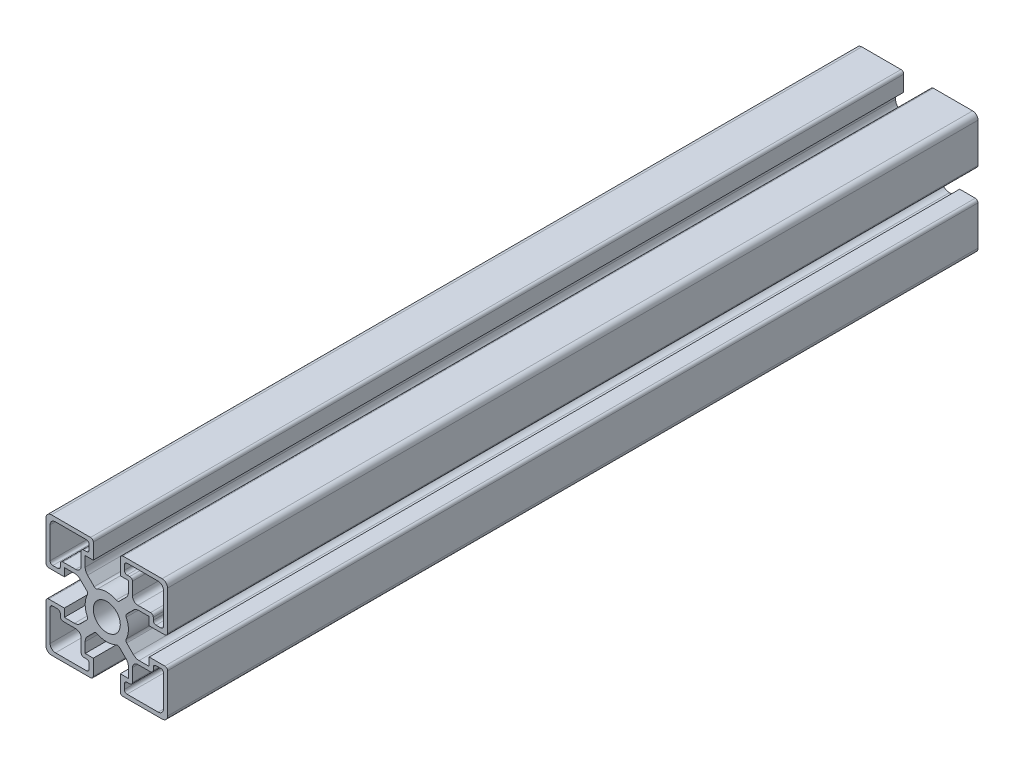
from build123d import *

# Parameters (mm, degrees)
SKETCH1_R           = 5
BOSS_EXTRUDE1_DEPTH = 300


with BuildPart() as part:
    # Sketch1 → Boss-Extrude1 (new body)
    with BuildSketch(Plane.XY):
        with BuildLine():
            Line((-5, -15.705854984), (-8, -15.705854984))
            Line((-8, -15.705854984), (-8, -11.948495671))
            ThreePointArc((-8, -11.948495671), (-7.771638598, -10.800445374), (-7.121320344, -9.827175327))
            Line((-7.121320344, -9.827175327), (-4.66838954, -7.374244523))
            ThreePointArc((-4.66838954, -7.374244523), (-4.125357909, -7.094903463), (-3.52114023, -7.183423382))
            ThreePointArc((-3.52114023, -7.183423382), (0, -8), (3.52114023, -7.183423382))
            ThreePointArc((3.52114023, -7.183423382), (4.125357909, -7.094903463), (4.66838954, -7.374244523))
            Line((4.66838954, -7.374244523), (7.121320344, -9.827175327))
            ThreePointArc((7.121320344, -9.827175327), (7.771638598, -10.800445374), (8, -11.948495671))
            Line((8, -11.948495671), (8, -15.705854984))
            Line((8, -15.705854984), (5, -15.705854984))
            Line((5, -15.705854984), (5, -21.5))
            ThreePointArc((5, -21.5), (5.292893219, -22.207106781), (6, -22.5))
            Line((6, -22.5), (20.5, -22.5))
            ThreePointArc((20.5, -22.5), (21.914213562, -21.914213562), (22.5, -20.5))
            Line((22.5, -20.5), (22.5, -6))
            ThreePointArc((22.5, -6), (22.207106781, -5.292893219), (21.5, -5))
            Line((21.5, -5), (15.705854984, -5))
            Line((15.705854984, -5), (15.705854984, -8))
            Line((15.705854984, -8), (11.948495671, -8))
            ThreePointArc((11.948495671, -8), (10.800445374, -7.771638598), (9.827175327, -7.121320344))
            Line((9.827175327, -7.121320344), (7.374244523, -4.66838954))
            ThreePointArc((7.374244523, -4.66838954), (7.094903463, -4.125357909), (7.183423382, -3.52114023))
            ThreePointArc((7.183423382, -3.52114023), (8, 0), (7.183423382, 3.52114023))
            ThreePointArc((7.183423382, 3.52114023), (7.094903463, 4.125357909), (7.374244523, 4.66838954))
            Line((7.374244523, 4.66838954), (9.827175327, 7.121320344))
            ThreePointArc((9.827175327, 7.121320344), (10.800445374, 7.771638598), (11.948495671, 8))
            Line((11.948495671, 8), (15.705854984, 8))
            Line((15.705854984, 8), (15.705854984, 5))
            Line((15.705854984, 5), (21.5, 5))
            ThreePointArc((21.5, 5), (22.207106781, 5.292893219), (22.5, 6))
            Line((22.5, 6), (22.5, 20.5))
            ThreePointArc((22.5, 20.5), (21.914213562, 21.914213562), (20.5, 22.5))
            Line((20.5, 22.5), (6, 22.5))
            ThreePointArc((6, 22.5), (5.292893219, 22.207106781), (5, 21.5))
            Line((5, 21.5), (5, 15.705854984))
            Line((5, 15.705854984), (8, 15.705854984))
            Line((8, 15.705854984), (8, 11.948495671))
            ThreePointArc((8, 11.948495671), (7.771638598, 10.800445374), (7.121320344, 9.827175327))
            Line((7.121320344, 9.827175327), (4.66838954, 7.374244523))
            ThreePointArc((4.66838954, 7.374244523), (4.125357909, 7.094903463), (3.52114023, 7.183423382))
            ThreePointArc((3.52114023, 7.183423382), (0, 8), (-3.52114023, 7.183423382))
            ThreePointArc((-3.52114023, 7.183423382), (-4.125357909, 7.094903463), (-4.66838954, 7.374244523))
            Line((-4.66838954, 7.374244523), (-7.121320344, 9.827175327))
            ThreePointArc((-7.121320344, 9.827175327), (-7.771638598, 10.800445374), (-8, 11.948495671))
            Line((-8, 11.948495671), (-8, 15.705854984))
            Line((-8, 15.705854984), (-5, 15.705854984))
            Line((-5, 15.705854984), (-5, 21.5))
            ThreePointArc((-5, 21.5), (-5.292893219, 22.207106781), (-6, 22.5))
            Line((-6, 22.5), (-20.5, 22.5))
            ThreePointArc((-20.5, 22.5), (-21.914213562, 21.914213562), (-22.5, 20.5))
            Line((-22.5, 20.5), (-22.5, 6))
            ThreePointArc((-22.5, 6), (-22.207106781, 5.292893219), (-21.5, 5))
            Line((-21.5, 5), (-15.705854984, 5))
            Line((-15.705854984, 5), (-15.705854984, 8))
            Line((-15.705854984, 8), (-11.948495671, 8))
            ThreePointArc((-11.948495671, 8), (-10.800445374, 7.771638598), (-9.827175327, 7.121320344))
            Line((-9.827175327, 7.121320344), (-7.374244523, 4.66838954))
            ThreePointArc((-7.374244523, 4.66838954), (-7.094903463, 4.125357909), (-7.183423382, 3.52114023))
            ThreePointArc((-7.183423382, 3.52114023), (-8, 0), (-7.183423382, -3.52114023))
            ThreePointArc((-7.183423382, -3.52114023), (-7.094903463, -4.125357909), (-7.374244523, -4.66838954))
            Line((-7.374244523, -4.66838954), (-9.827175327, -7.121320344))
            ThreePointArc((-9.827175327, -7.121320344), (-10.800445374, -7.771638598), (-11.948495671, -8))
            Line((-11.948495671, -8), (-15.705854984, -8))
            Line((-15.705854984, -8), (-15.705854984, -5))
            Line((-15.705854984, -5), (-21.5, -5))
            ThreePointArc((-21.5, -5), (-22.207106781, -5.292893219), (-22.5, -6))
            Line((-22.5, -6), (-22.5, -20.5))
            ThreePointArc((-22.5, -20.5), (-21.914213562, -21.914213562), (-20.5, -22.5))
            Line((-20.5, -22.5), (-6, -22.5))
            ThreePointArc((-6, -22.5), (-5.292893219, -22.207106781), (-5, -21.5))
            Line((-5, -21.5), (-5, -15.705854984))
        make_face()
        Circle(SKETCH1_R, mode=Mode.SUBTRACT)
        with BuildLine():
            Line((-19, -21), (-7.5, -21))
            ThreePointArc((-7.5, -21), (-6.792893219, -20.707106781), (-6.5, -20))
            Line((-6.5, -20), (-6.5, -18.205854984))
            ThreePointArc((-6.5, -18.205854984), (-6.792893219, -17.498748202), (-7.5, -17.205854984))
            Line((-7.5, -17.205854984), (-8.5, -17.205854984))
            ThreePointArc((-8.5, -17.205854984), (-9.207106781, -16.912961765), (-9.5, -16.205854984))
            Line((-9.5, -16.205854984), (-9.5, -11.5))
            ThreePointArc((-9.5, -11.5), (-10.085786438, -10.085786438), (-11.5, -9.5))
            Line((-11.5, -9.5), (-16.205854984, -9.5))
            ThreePointArc((-16.205854984, -9.5), (-16.912961765, -9.207106781), (-17.205854984, -8.5))
            Line((-17.205854984, -8.5), (-17.205854984, -7.5))
            ThreePointArc((-17.205854984, -7.5), (-17.498748202, -6.792893219), (-18.205854984, -6.5))
            Line((-18.205854984, -6.5), (-20, -6.5))
            ThreePointArc((-20, -6.5), (-20.707106781, -6.792893219), (-21, -7.5))
            Line((-21, -7.5), (-21, -19))
            ThreePointArc((-21, -19), (-20.414213562, -20.414213562), (-19, -21))
        make_face(mode=Mode.SUBTRACT)
        with BuildLine():
            Line((-9.5, 16.205854984), (-9.5, 11.5))
            ThreePointArc((-9.5, 11.5), (-10.085786438, 10.085786438), (-11.5, 9.5))
            Line((-11.5, 9.5), (-16.205854984, 9.5))
            ThreePointArc((-16.205854984, 9.5), (-16.912961765, 9.207106781), (-17.205854984, 8.5))
            Line((-17.205854984, 8.5), (-17.205854984, 7.5))
            ThreePointArc((-17.205854984, 7.5), (-17.498748202, 6.792893219), (-18.205854984, 6.5))
            Line((-18.205854984, 6.5), (-20, 6.5))
            ThreePointArc((-20, 6.5), (-20.707106781, 6.792893219), (-21, 7.5))
            Line((-21, 7.5), (-21, 19))
            ThreePointArc((-21, 19), (-20.414213562, 20.414213562), (-19, 21))
            Line((-19, 21), (-7.5, 21))
            ThreePointArc((-7.5, 21), (-6.792893219, 20.707106781), (-6.5, 20))
            Line((-6.5, 20), (-6.5, 18.205854984))
            ThreePointArc((-6.5, 18.205854984), (-6.792893219, 17.498748202), (-7.5, 17.205854984))
            Line((-7.5, 17.205854984), (-8.5, 17.205854984))
            ThreePointArc((-8.5, 17.205854984), (-9.207106781, 16.912961765), (-9.5, 16.205854984))
        make_face(mode=Mode.SUBTRACT)
        with BuildLine():
            Line((16.205854984, 9.5), (11.5, 9.5))
            ThreePointArc((11.5, 9.5), (10.085786438, 10.085786438), (9.5, 11.5))
            Line((9.5, 11.5), (9.5, 16.205854984))
            ThreePointArc((9.5, 16.205854984), (9.207106781, 16.912961765), (8.5, 17.205854984))
            Line((8.5, 17.205854984), (7.5, 17.205854984))
            ThreePointArc((7.5, 17.205854984), (6.792893219, 17.498748202), (6.5, 18.205854984))
            Line((6.5, 18.205854984), (6.5, 20))
            ThreePointArc((6.5, 20), (6.792893219, 20.707106781), (7.5, 21))
            Line((7.5, 21), (19, 21))
            ThreePointArc((19, 21), (20.414213562, 20.414213562), (21, 19))
            Line((21, 19), (21, 7.5))
            ThreePointArc((21, 7.5), (20.707106781, 6.792893219), (20, 6.5))
            Line((20, 6.5), (18.205854984, 6.5))
            ThreePointArc((18.205854984, 6.5), (17.498748202, 6.792893219), (17.205854984, 7.5))
            Line((17.205854984, 7.5), (17.205854984, 8.5))
            ThreePointArc((17.205854984, 8.5), (16.912961765, 9.207106781), (16.205854984, 9.5))
        make_face(mode=Mode.SUBTRACT)
        with BuildLine():
            Line((9.5, -16.205854984), (9.5, -11.5))
            ThreePointArc((9.5, -11.5), (10.085786438, -10.085786438), (11.5, -9.5))
            Line((11.5, -9.5), (16.205854984, -9.5))
            ThreePointArc((16.205854984, -9.5), (16.912961765, -9.207106781), (17.205854984, -8.5))
            Line((17.205854984, -8.5), (17.205854984, -7.5))
            ThreePointArc((17.205854984, -7.5), (17.498748202, -6.792893219), (18.205854984, -6.5))
            Line((18.205854984, -6.5), (20, -6.5))
            ThreePointArc((20, -6.5), (20.707106781, -6.792893219), (21, -7.5))
            Line((21, -7.5), (21, -19))
            ThreePointArc((21, -19), (20.414213562, -20.414213562), (19, -21))
            Line((19, -21), (7.5, -21))
            ThreePointArc((7.5, -21), (6.792893219, -20.707106781), (6.5, -20))
            Line((6.5, -20), (6.5, -18.205854984))
            ThreePointArc((6.5, -18.205854984), (6.792893219, -17.498748202), (7.5, -17.205854984))
            Line((7.5, -17.205854984), (8.5, -17.205854984))
            ThreePointArc((8.5, -17.205854984), (9.207106781, -16.912961765), (9.5, -16.205854984))
        make_face(mode=Mode.SUBTRACT)
    extrude(amount=BOSS_EXTRUDE1_DEPTH)


solid = part.part
